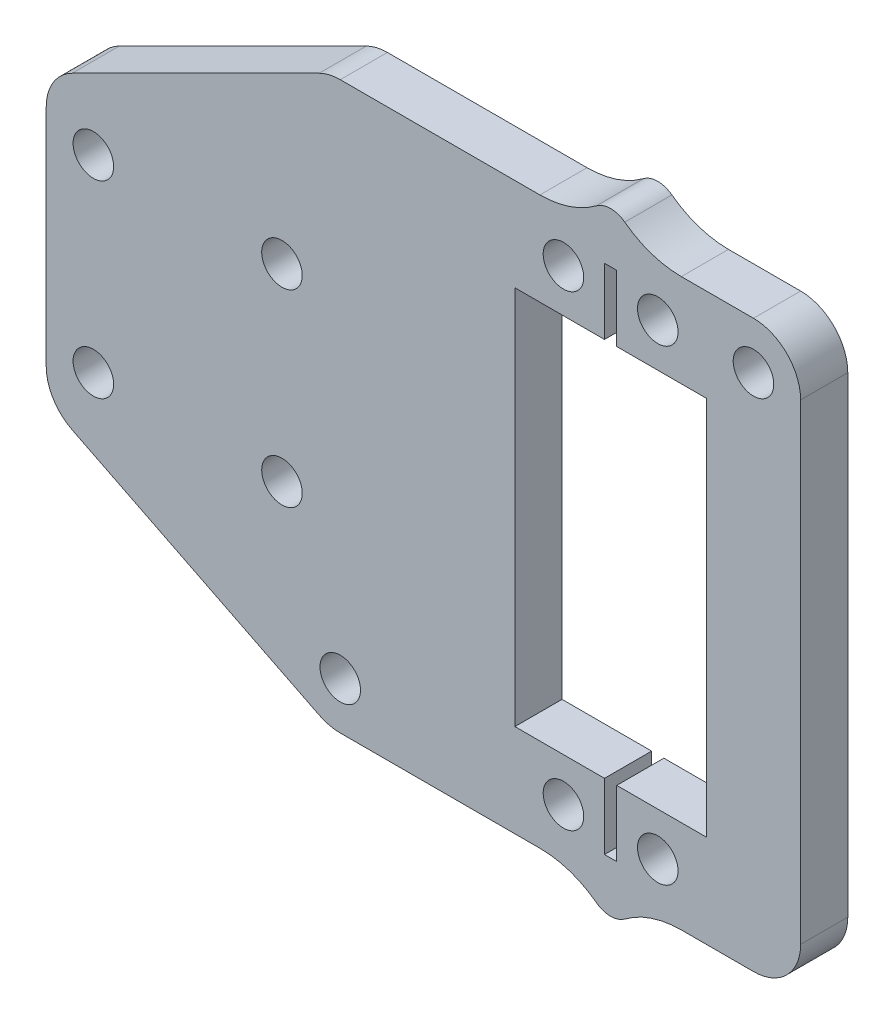
from build123d import *

# Parameters (mm, degrees)
SKETCH_1_W          = 80
SKETCH_1_H          = 60
SKETCH_1_R          = 2.15
EXTRUDE_1_DEPTH     = 5
SKETCH_2_R          = 2.15
CUT_EXTRUDE_1_DEPTH = 68.134361545
SKETCH_3_R          = 2.15
CUT_EXTRUDE_2_DEPTH = 68.134361545
CUT_EXTRUDE_3_DEPTH = 68.134361545
FILLET_1_R          = 5
SKETCH_5_R          = 2.15
CUT_EXTRUDE_4_DEPTH = 68.134361545
FILLET_2_R          = 5
EXTRUDE_2_DEPTH     = 5
FILLET_3_R          = 10


with BuildPart() as part:
    # ｽｹｯﾁ1 → ﾎﾞｽ - 押し出し1 (new body)
    with BuildSketch(Plane.XY):
        with Locations((-19.85, 0)):
            Rectangle(SKETCH_1_W, SKETCH_1_H)
        with Locations((-5, -24.75)):
            Circle(SKETCH_1_R, mode=Mode.SUBTRACT)
        with Locations((5, -24.75)):
            Circle(SKETCH_1_R, mode=Mode.SUBTRACT)
        Polygon((0.65, -20.15), (0.65, -27.15), (-0.65, -27.15), (-0.65, -20.15), (-10.15, -20.15), (-10.15, 20.15), (-0.65, 20.15), (-0.65, 27.15), (0.65, 27.15), (0.65, 20.15), (10.15, 20.15), (10.15, -20.15), align=None, mode=Mode.SUBTRACT)
        with Locations((-5, 24.75)):
            Circle(SKETCH_1_R, mode=Mode.SUBTRACT)
        with Locations((5, 24.75)):
            Circle(SKETCH_1_R, mode=Mode.SUBTRACT)
    extrude(amount=EXTRUDE_1_DEPTH)

    # ｽｹｯﾁ2 → ｶｯﾄ - 押し出し1 (cut, through all)
    with BuildSketch(Plane.XY.offset(5)):
        with Locations((-54.85, 10)):
            Circle(SKETCH_2_R)
        with Locations(Location((-54.85, -10, 0), (0, 0, 180))):
            Circle(SKETCH_2_R)
        with Locations((-34.85, 10)):
            Circle(SKETCH_2_R)
        with Locations(Location((-34.85, -10, 0), (0, 0, 180))):
            Circle(SKETCH_2_R)
    extrude(amount=-CUT_EXTRUDE_1_DEPTH, mode=Mode.SUBTRACT)

    # ｽｹｯﾁ3 → ｶｯﾄ - 押し出し2 (cut, through all)
    with BuildSketch(Plane.XY.offset(5)):
        with Locations((15.15, 25)):
            Circle(SKETCH_3_R)
        with BuildLine():
            ThreePointArc((15.15, 30), (18.685533906, 28.535533906), (20.15, 25))
            Line((20.15, 25), (20.15, 30))
            Line((20.15, 30), (15.15, 30))
        make_face()
    extrude(amount=-CUT_EXTRUDE_2_DEPTH, mode=Mode.SUBTRACT)

    # ｽｹｯﾁ4 → ｶｯﾄ - 押し出し3 (cut, through all)
    with BuildSketch(Plane.XY.offset(5)):
        Polygon((-59.85, 30), (-59.85, 15.001700458), (-29.85, 30), align=None)
        Polygon((-29.85, -30), (-59.85, -15.001700458), (-59.85, -30), align=None)
    extrude(amount=-CUT_EXTRUDE_3_DEPTH, mode=Mode.SUBTRACT)

    # ﾌｨﾚｯﾄ1
    fillet_1_edges = [part.edges().sort_by_distance(p)[0] for p in [
        (20.15, -30, 2.5),
    ]]
    fillet(fillet_1_edges, radius=FILLET_1_R)

    # ｽｹｯﾁ5 → ｶｯﾄ - 押し出し4 (cut, through all)
    with BuildSketch(Plane.XY.offset(5)):
        with Locations((-28.669779796, -25)):
            Circle(SKETCH_5_R)
    extrude(amount=-CUT_EXTRUDE_4_DEPTH, mode=Mode.SUBTRACT)

    # ﾌｨﾚｯﾄ2
    fillet_2_edges = [part.edges().sort_by_distance(p)[0] for p in [
        (-59.85, 15.001700458, 2.5),
        (-29.85, 30, 2.5),
        (-59.85, -15.001700458, 2.5),
        (-29.85, -30, 2.5),
    ]]
    fillet(fillet_2_edges, radius=FILLET_2_R)

    # ｽｹｯﾁ6 → ﾎﾞｽ - 押し出し2 (add)
    with BuildSketch(Plane.XY.offset(5)):
        with BuildLine():
            ThreePointArc((2.5, 30), (0, 32.5), (-2.5, 30))
            Line((-2.5, 30), (2.5, 30))
        make_face()
        with BuildLine():
            Line((2.5, 30), (-2.5, 30))
            ThreePointArc((-2.5, 30), (0, 27.5), (2.5, 30))
        make_face()
        with BuildLine():
            ThreePointArc((2.5, -30), (0, -27.5), (-2.5, -30))
            Line((-2.5, -30), (2.5, -30))
        make_face()
        with BuildLine():
            Line((2.5, -30), (-2.5, -30))
            ThreePointArc((-2.5, -30), (0, -32.5), (2.5, -30))
        make_face()
    extrude(amount=-EXTRUDE_2_DEPTH)

    # ﾌｨﾚｯﾄ3
    fillet_3_edges = [part.edges().sort_by_distance(p)[0] for p in [
        (2.5, 30, 2.5),
        (-2.5, 30, 2.5),
        (2.5, -30, 2.5),
        (-2.5, -30, 2.5),
    ]]
    fillet(fillet_3_edges, radius=FILLET_3_R)


solid = part.part
